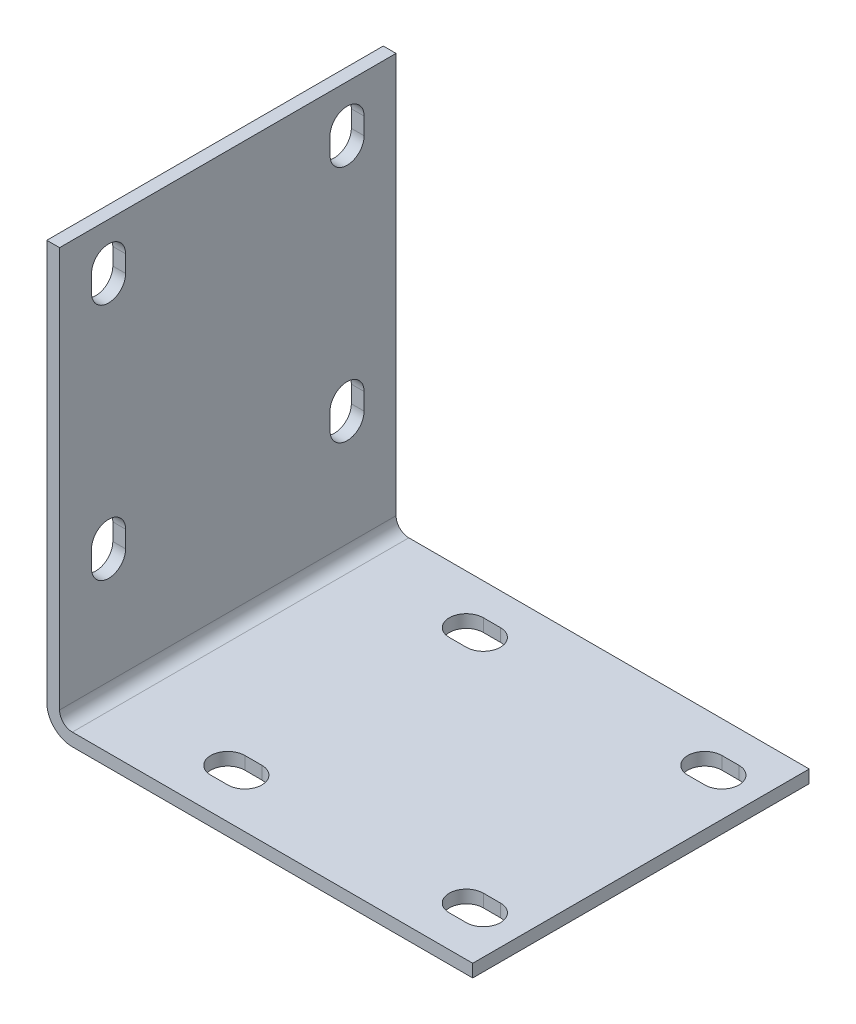
from build123d import *

# Parameters (mm, degrees)
BOSS_EXTRUDE1_DEPTH = 62.70625
CUT_EXTRUDE1_DEPTH  = 224.410663511


with BuildPart() as part:
    # Sketch1 → Boss-Extrude1 (new, symmetric)
    with BuildSketch(Plane.XY):
        with BuildLine():
            Line((-9.525, 149.225), (-4.7625, 149.225))
            Line((-4.7625, 149.225), (-4.7625, 0))
            ThreePointArc((-4.7625, 0), (-3.367596045, -3.367596045), (0, -4.7625))
            Line((0, -4.7625), (149.225, -4.7625))
            Line((149.225, -4.7625), (149.225, -9.525))
            Line((149.225, -9.525), (0, -9.525))
            ThreePointArc((0, -9.525), (-6.735192091, -6.735192091), (-9.525, 0))
            Line((-9.525, 0), (-9.525, 149.225))
        make_face()
    extrude(amount=BOSS_EXTRUDE1_DEPTH, both=True)

    # Sketch2 → Cut-Extrude1 (cut, through all)
    with BuildSketch(Plane(origin=(-4.7625, 0, 0), x_dir=(0, 0, -1), z_dir=(1, 0, 0))):
        with BuildLine():
            Line((-50.8, 134.9375), (-50.8, 128.5875))
            ThreePointArc((-50.8, 128.5875), (-44.45, 122.2375), (-38.1, 128.5875))
            Line((-38.1, 128.5875), (-38.1, 134.9375))
            ThreePointArc((-38.1, 134.9375), (-44.45, 141.2875), (-50.8, 134.9375))
        make_face()
        with BuildLine():
            Line((-50.8, 46.0375), (-50.8, 39.6875))
            ThreePointArc((-50.8, 39.6875), (-44.45, 33.3375), (-38.1, 39.6875))
            Line((-38.1, 39.6875), (-38.1, 46.0375))
            ThreePointArc((-38.1, 46.0375), (-44.45, 52.3875), (-50.8, 46.0375))
        make_face()
        with BuildLine():
            Line((38.1, 39.6875), (38.1, 46.0375))
            ThreePointArc((38.1, 46.0375), (44.45, 52.3875), (50.8, 46.0375))
            Line((50.8, 46.0375), (50.8, 39.6875))
            ThreePointArc((50.8, 39.6875), (44.45, 33.3375), (38.1, 39.6875))
        make_face()
        with BuildLine():
            Line((38.1, 134.9375), (38.1, 128.5875))
            ThreePointArc((38.1, 128.5875), (44.45, 122.2375), (50.8, 128.5875))
            Line((50.8, 128.5875), (50.8, 134.9375))
            ThreePointArc((50.8, 134.9375), (44.45, 141.2875), (38.1, 134.9375))
        make_face()
    cut_extrude1 = extrude(amount=-CUT_EXTRUDE1_DEPTH, mode=Mode.SUBTRACT)

    # Mirror1: Cut-Extrude1 across plane
    add(cut_extrude1.mirror(Plane(origin=(0, 0, 0), x_dir=(0, 0, 1), z_dir=(0.7071067811865475, -0.7071067811865476, 0))), mode=Mode.SUBTRACT)


solid = part.part
